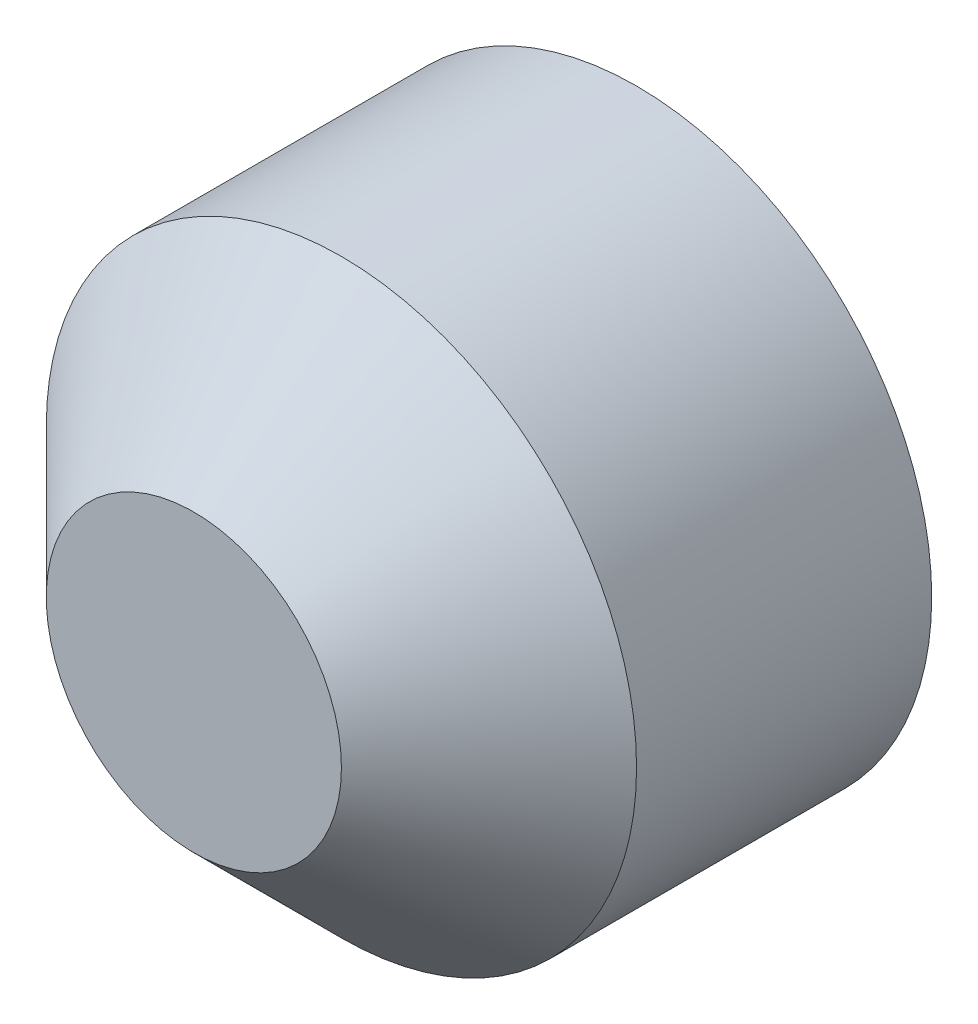
from build123d import *


with BuildPart() as part:
    # Sketch1 → Revolve1 (revolve)
    with BuildSketch(Plane(origin=(0, 0, 0), x_dir=(0, 0, -1), z_dir=(1, 0, 0))):
        Polygon((0, 0), (0, 100), (-100, 100), (-150, 50), (-150, 0), align=None)
    revolve(axis=Axis((0, 0, 150), (0, 0, -1)))


solid = part.part
